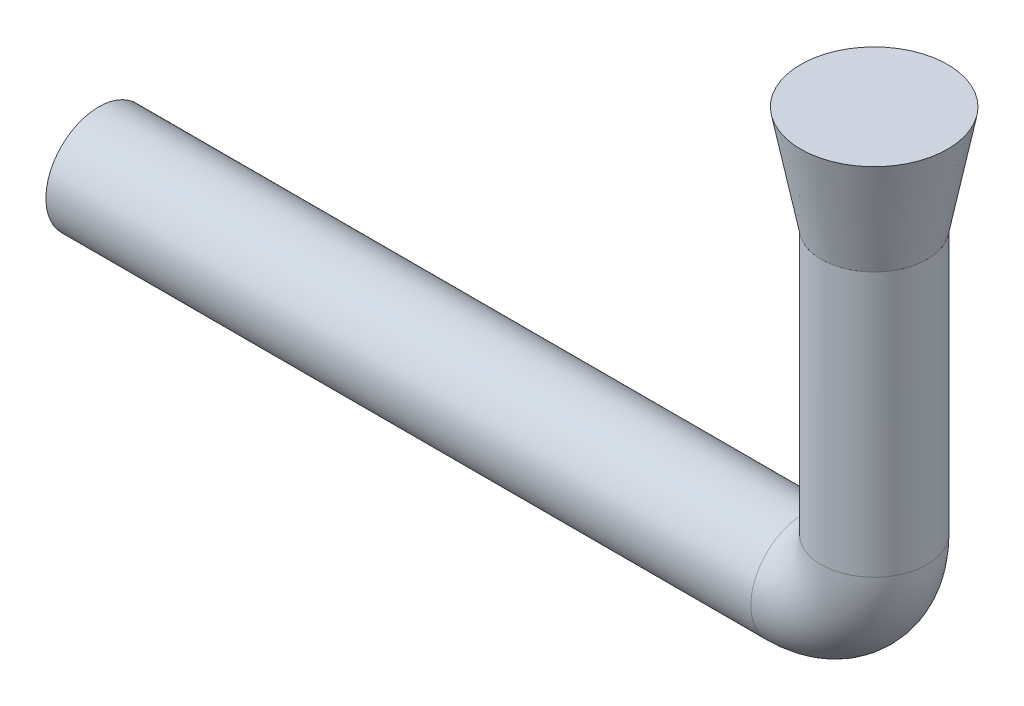
from build123d import *

# Parameters (mm, degrees)
SWEEP1_PROFILE_R    = 15
SKETCH30_R          = 15
BOSS_EXTRUDE1_DEPTH = 30
BOSS_EXTRUDE1_DRAFT = -11


with BuildPart() as part:
    # Sweep1: sweep along a path in Sketch1
    with BuildLine(Plane.XY) as sweep1_path:
        Line((0, 0), (200, 0))
        ThreePointArc((200, 0), (214.142135624, 5.857864376), (220, 20))
        Line((220, 20), (220, 95))
    # Sweep1 profile (on start of the path) → Sweep1 (sweep)
    with BuildSketch(Plane(origin=(0, 0, 0), x_dir=(0, 0, 1), z_dir=(1, 0, 0))):
        Circle(SWEEP1_PROFILE_R)
    sweep(path=sweep1_path.line)


with BuildPart() as body_2:
    # Sketch30 → Boss-Extrude1 (with draft: the straight prism first)
    with BuildSketch(Plane(origin=(0, 95, 0), x_dir=(1, 0, 0), z_dir=(0, 1, 0))):
        with Locations((220, 0)):
            Circle(SKETCH30_R)
    extrude(amount=BOSS_EXTRUDE1_DEPTH)
    # Boss-Extrude1: the draft: its side faces are tilted about the plane it starts from
    boss_extrude1_sides = [body_2.faces().sort_by_distance(p)[0] for p in [
        (205, 110, 0),
    ]]
    draft(boss_extrude1_sides, Plane(origin=(0, 95, 0), x_dir=(1, 0, 0), z_dir=(0, 1, 0)), BOSS_EXTRUDE1_DRAFT)


solid = Compound([part.part, body_2.part])
